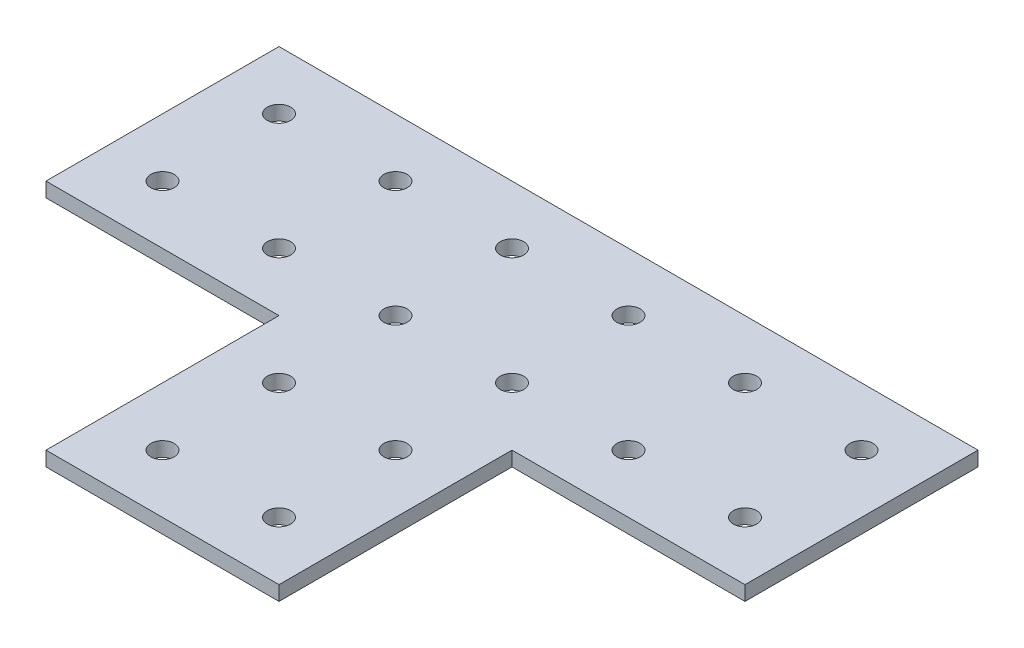
from build123d import *

# Parameters (mm, degrees)
BOSS_EXTRUDE1_DEPTH  = 3.175
SKETCH2_R            = 2.54
CUT_EXTRUDE1_DEPTH   = 3.175
LPATTERN1_COUNT      = 6
LPATTERN1_PITCH      = 25.4
LPATTERN1_COUNT_DIR2 = 2
LPATTERN1_PITCH_DIR2 = 25.4
SKETCH3_R            = 2.54
CUT_EXTRUDE2_DEPTH   = 3.175
LPATTERN2_COUNT      = 2
LPATTERN2_PITCH      = 25.4
LPATTERN2_COUNT_DIR2 = 2
LPATTERN2_PITCH_DIR2 = 25.4


with BuildPart() as part:
    # Sketch1 → Boss-Extrude1 (new body)
    with BuildSketch(Plane(origin=(0, 0, 0), x_dir=(1, 0, 0), z_dir=(0, 1, 0))):
        Polygon((25.4, -25.4), (76.2, -25.4), (76.2, 25.4), (-76.2, 25.4), (-76.2, -25.4), (-25.4, -25.4), (-25.4, -76.2), (25.4, -76.2), align=None)
    extrude(amount=BOSS_EXTRUDE1_DEPTH)

    # Sketch2 → Cut-Extrude1 (cut)
    with BuildSketch(Plane(origin=(0, 3.175, 0), x_dir=(1, 0, 0), z_dir=(0, 1, 0))):
        with Locations(Location((-63.5, 12.7, 0), (0, 0, 270))):
            Circle(SKETCH2_R)
    cut_extrude1 = extrude(amount=-CUT_EXTRUDE1_DEPTH, mode=Mode.SUBTRACT)

    # LPattern1: Cut-Extrude1 6 × 2
    with Locations(*[(i * LPATTERN1_PITCH, 0, j * LPATTERN1_PITCH_DIR2) for i in range(LPATTERN1_COUNT) for j in range(LPATTERN1_COUNT_DIR2) if (i, j) != (0, 0)]):
        add(cut_extrude1, mode=Mode.SUBTRACT)

    # Sketch3 → Cut-Extrude2 (cut)
    with BuildSketch(Plane(origin=(0, 3.175, 0), x_dir=(1, 0, 0), z_dir=(0, 1, 0))):
        with Locations(Location((-12.7, -63.5, 0), (0, 0, 270))):
            Circle(SKETCH3_R)
    cut_extrude2 = extrude(amount=-CUT_EXTRUDE2_DEPTH, mode=Mode.SUBTRACT)

    # LPattern2: Cut-Extrude2 2 × 2
    with Locations(*[(i * LPATTERN2_PITCH, 0, -j * LPATTERN2_PITCH_DIR2) for i in range(LPATTERN2_COUNT) for j in range(LPATTERN2_COUNT_DIR2) if (i, j) != (0, 0)]):
        add(cut_extrude2, mode=Mode.SUBTRACT)


solid = part.part
